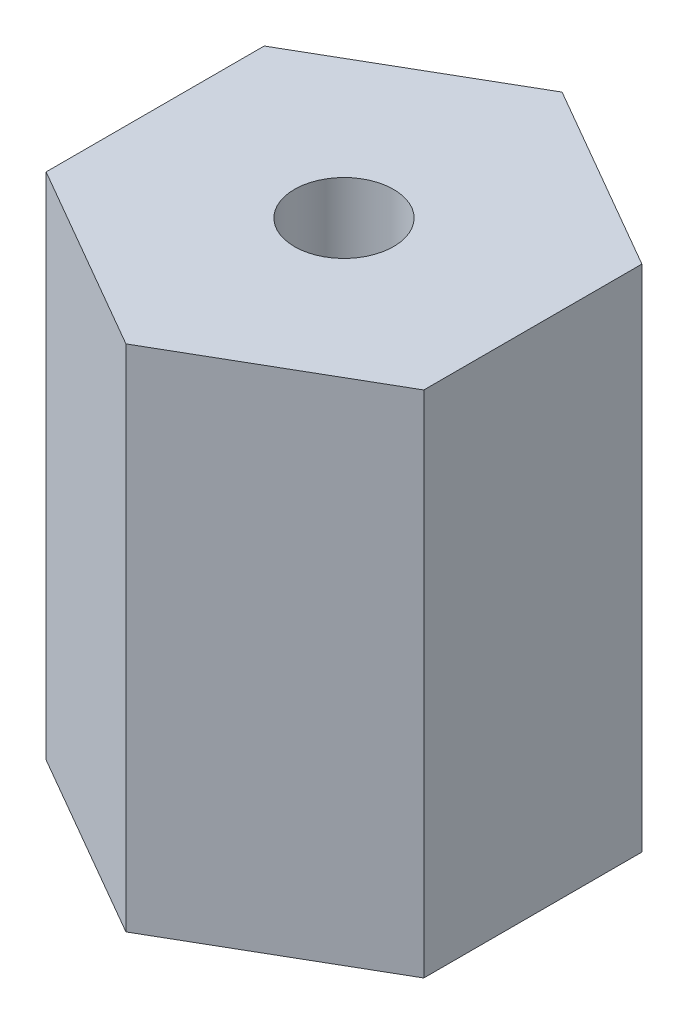
from build123d import *

# Parameters (mm, degrees)
BOSS_EXTRUDE1_DEPTH = 6.096
SKETCH3_R           = 0.593671867
CUT_EXTRUDE1_DEPTH  = 8.00608865


with BuildPart() as part:
    # Sketch1 → Boss-Extrude1 (new body)
    with BuildSketch(Plane(origin=(0, 0, 0), x_dir=(1, 0, 0), z_dir=(0, 1, 0))):
        Polygon((2.2606, 1.305158019), (0, 2.610316037), (-2.2606, 1.305158019), (-2.2606, -1.305158019), (0, -2.610316037), (2.2606, -1.305158019), align=None)
    extrude(amount=BOSS_EXTRUDE1_DEPTH)

    # Sketch3 → Cut-Extrude1 (cut, through all)
    with BuildSketch(Plane(origin=(0, 6.096, 0), x_dir=(1, 0, 0), z_dir=(0, 1, 0))):
        with Locations(Location((0, 0, 0), (0, 0, 270))):
            Circle(SKETCH3_R)
    extrude(amount=-CUT_EXTRUDE1_DEPTH, mode=Mode.SUBTRACT)


solid = part.part
